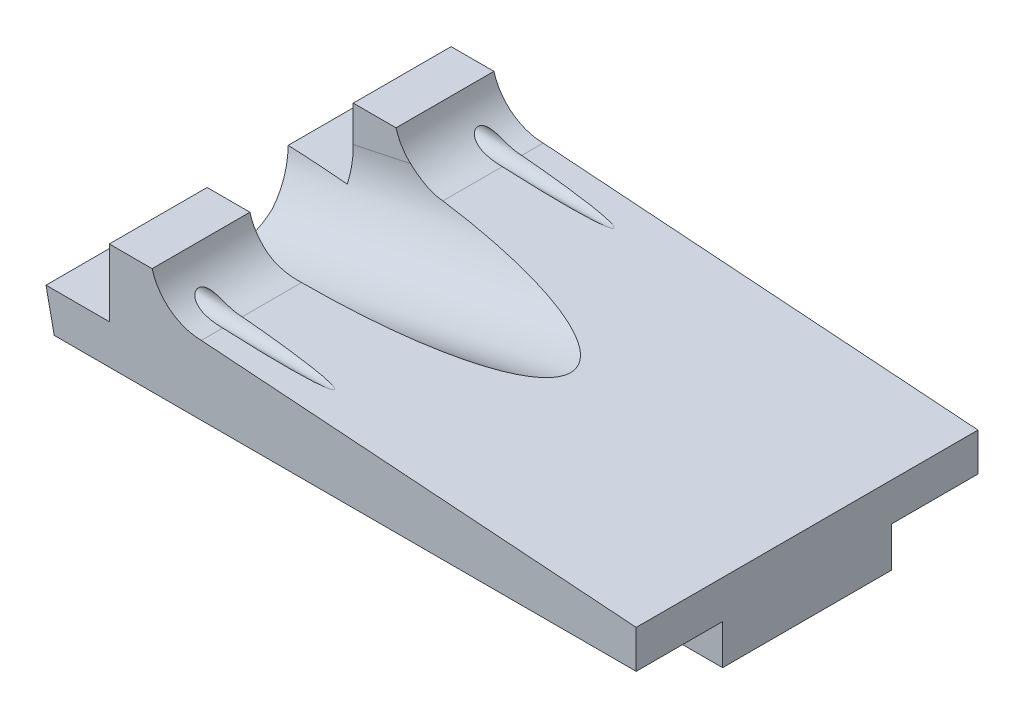
from build123d import *

# Parameters (mm, degrees)
SKETCH1_W           = 91.6
SKETCH1_H           = 26.6
BOSS_EXTRUDE1_DEPTH = 6.3
SKETCH2_W           = 91.6
SKETCH2_H           = 53.8
BOSS_EXTRUDE2_DEPTH = 6
BOSS_EXTRUDE3_REACH = 108.941
SKETCH5_R           = 11.5
CUT_EXTRUDE1_DEPTH  = 56.5
SKETCH6_W           = 23
SKETCH6_H           = 11
CUT_EXTRUDE2_DEPTH  = 40
SKETCH8_R           = 1.6
CUT_EXTRUDE3_DEPTH  = 6
CUT_EXTRUDE4_REACH  = 111.225
SKETCH10_W          = 53.8
SKETCH10_H          = 10.6
CUT_EXTRUDE5_DEPTH  = 2.3
CUT_EXTRUDE6_REACH  = 97.014
SKETCH11_R          = 1.6


with BuildPart() as part:
    # Sketch1 → Boss-Extrude1 (new body)
    with BuildSketch(Plane(origin=(0, 0, 0), x_dir=(1, 0, 0), z_dir=(0, 1, 0))):
        with Locations((45.8, 13.3)):
            Rectangle(SKETCH1_W, SKETCH1_H)
    extrude(amount=BOSS_EXTRUDE1_DEPTH)

    # Sketch2 → Boss-Extrude2 (add)
    with BuildSketch(Plane(origin=(0, 6.3, 0), x_dir=(1, 0, 0), z_dir=(0, 1, 0))):
        with Locations((45.8, 13.3)):
            Rectangle(SKETCH2_W, SKETCH2_H)
    extrude(amount=BOSS_EXTRUDE2_DEPTH)

    # Boss-Extrude3: up to this face of the body (flat: up to its plane)
    boss_extrude3_end = Plane(part.part.faces().sort_by_distance((45.8, 9.3, -40.2))[0])
    # Sketch3 → Boss-Extrude3 (add, up to the picked face)
    with BuildSketch(Plane.XY.offset(13.6), mode=Mode.PRIVATE) as boss_extrude3_sk1:
        with BuildLine():
            Line((91.6, 12.3), (23.155649055, 17.195554695))
            ThreePointArc((23.155649055, 17.195554695), (17.419589145, 19.620522611), (15.1, 25.4))
            Line((15.1, 25.4), (-4, 25.4))
            Line((-4, 25.4), (0, 6.3))
            Line((0, 6.3), (0, 12.3))
            Line((0, 12.3), (91.6, 12.3))
        make_face()
    boss_extrude3_tool1 = split(extrude(boss_extrude3_sk1.sketch, amount=-BOSS_EXTRUDE3_REACH, mode=Mode.PRIVATE), bisect_by=boss_extrude3_end, keep=Keep.BOTH, mode=Mode.PRIVATE)
    add(boss_extrude3_tool1.solids().sort_by(Axis((22.17792, 16.713333, 13.6), (0, 0, -1)))[0])

    # Sketch5 → Cut-Extrude1 (cut, symmetric)
    with BuildSketch(Plane(origin=(1.263937397, 0.264698931, 0), x_dir=(0, 0, 1), z_dir=(-0.9787667222739368, -0.2049773240364267, 0))):
        with Locations((-13.3, 15)):
            Circle(SKETCH5_R)
    extrude(amount=CUT_EXTRUDE1_DEPTH, both=True, mode=Mode.SUBTRACT)

    # Sketch6 → Cut-Extrude2 (cut, symmetric)
    with BuildSketch(Plane(origin=(1.263937397, 0.264698931, 0), x_dir=(0, 0, 1), z_dir=(-0.9787667222739368, -0.2049773240364267, 0))):
        with Locations((-13.295563207, 20.180584042)):
            Rectangle(SKETCH6_W, SKETCH6_H)
    extrude(amount=CUT_EXTRUDE2_DEPTH, both=True, mode=Mode.SUBTRACT)

    # Sketch8 → Cut-Extrude3 (cut)
    with BuildSketch(Plane.XZ):
        with Locations(Location((15.8, -4.3, 0), (0, 0, 270))):
            Circle(SKETCH8_R)
        with Locations(Location((85.8, -4.3, 0), (0, 0, 270))):
            Circle(SKETCH8_R)
        with Locations(Location((85.8, -22.3, 0), (0, 0, 270))):
            Circle(SKETCH8_R)
        with Locations(Location((15.8, -22.3, 0), (0, 0, 270))):
            Circle(SKETCH8_R)
    extrude(amount=-CUT_EXTRUDE3_DEPTH, mode=Mode.SUBTRACT)

    # Cut-Extrude4: up to this face of the body (flat: up to its plane)
    cut_extrude4_end = Plane(part.part.faces().sort_by_distance((35.074761292, 12.665908848, -40.2))[0])
    # Sketch9 → Cut-Extrude4 (cut, up to the picked face)
    with BuildSketch(Plane.XY.offset(13.6), mode=Mode.PRIVATE) as cut_extrude4_sk1:
        with BuildLine():
            Line((-1.298429319, 12.5), (6.366705086, 12.5))
            Line((6.366705086, 12.5), (6.366705086, 23.1))
            Line((6.366705086, 23.1), (15.402527223, 23.1))
            ThreePointArc((15.402527223, 23.1), (15.168498155, 24.239113564), (15.1, 25.4))
            Line((15.1, 25.4), (-4, 25.4))
            Line((-4, 25.4), (-1.298429319, 12.5))
        make_face()
    cut_extrude4_tool1 = split(extrude(cut_extrude4_sk1.sketch, amount=-CUT_EXTRUDE4_REACH, mode=Mode.PRIVATE), bisect_by=cut_extrude4_end, keep=Keep.BOTH, mode=Mode.PRIVATE)
    add(cut_extrude4_tool1.solids().sort_by(Axis((3.156249, 20.011038, 13.6), (0, 0, -1)))[0], mode=Mode.SUBTRACT)

    # Sketch10 → Cut-Extrude5 (cut)
    with BuildSketch(Plane.ZY.offset(-6.366705086)):
        with Locations((-13.3, 17.8)):
            Rectangle(SKETCH10_W, SKETCH10_H)
    extrude(amount=-CUT_EXTRUDE5_DEPTH, mode=Mode.SUBTRACT)

    # Sketch11 → Cut-Extrude6 (cut, up to next)
    with BuildSketch(Plane.ZY.offset(-8.666705086), mode=Mode.PRIVATE) as cut_extrude6_sk1:
        with Locations((-35.3, 17.65)):
            Circle(SKETCH11_R)
    cut_extrude6_tool1 = extrude(cut_extrude6_sk1.sketch, amount=-CUT_EXTRUDE6_REACH, mode=Mode.PRIVATE) & part.part
    # Sketch11 → Cut-Extrude6 (cut, up to next)
    with BuildSketch(Plane.ZY.offset(-8.666705086), mode=Mode.PRIVATE) as cut_extrude6_sk2:
        with Locations((8.7, 17.65)):
            Circle(SKETCH11_R)
    cut_extrude6_tool2 = extrude(cut_extrude6_sk2.sketch, amount=-CUT_EXTRUDE6_REACH, mode=Mode.PRIVATE) & part.part
    add(cut_extrude6_tool1.solids().sort_by_distance((8.666705, 17.65, -35.3))[0], mode=Mode.SUBTRACT)
    add(cut_extrude6_tool2.solids().sort_by_distance((8.666705, 17.65, 8.7))[0], mode=Mode.SUBTRACT)


solid = part.part
